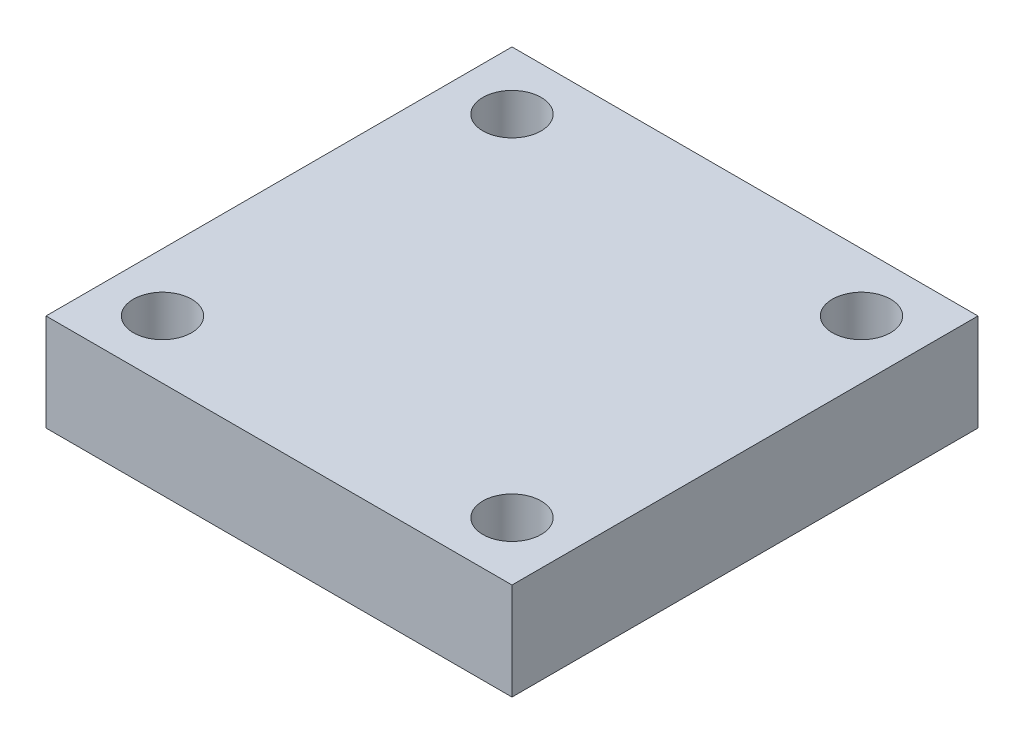
from build123d import *

# Parameters (mm, degrees)
SKETCH_1_W          = 24
SKETCH_1_H          = 24
EXTRUDE_1_DEPTH     = 5
SKETCH_2_R          = 1.5
CUT_EXTRUDE_1_DEPTH = 24.285415338


with BuildPart() as part:
    # 草图1 → 凸台-拉伸1 (new body)
    with BuildSketch(Plane(origin=(0, 0, 0), x_dir=(1, 0, 0), z_dir=(0, 1, 0))):
        with Locations((5.811531045, 2.140718838)):
            Rectangle(SKETCH_1_W, SKETCH_1_H)
    extrude(amount=EXTRUDE_1_DEPTH)

    # 草图2 → 切除-拉伸1 (cut, through all)
    with BuildSketch(Plane(origin=(0, 0, 0), x_dir=(1, 0, 0), z_dir=(0, 1, 0))):
        with Locations(Location((-3.188468955, 11.140718838, 0), (0, 0, 270))):
            Circle(SKETCH_2_R)
        with Locations(Location((-3.188468955, -6.859281162, 0), (0, 0, 90))):
            Circle(SKETCH_2_R)
        with Locations(Location((14.811531045, -6.859281162, 0), (0, 0, 270))):
            Circle(SKETCH_2_R)
        with Locations(Location((14.811531045, 11.140718838, 0), (0, 0, 90))):
            Circle(SKETCH_2_R)
    extrude(amount=CUT_EXTRUDE_1_DEPTH, mode=Mode.SUBTRACT)


solid = part.part
